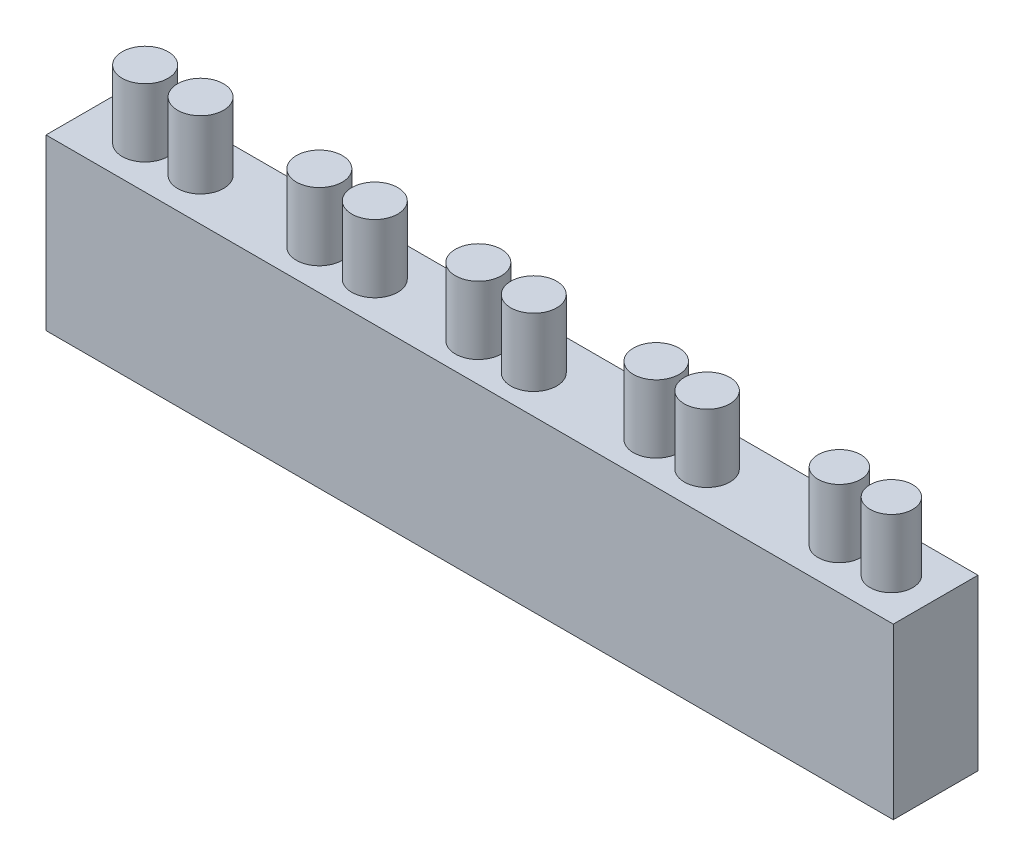
from build123d import *

# Parameters (mm, degrees)
SKETCH1_W           = 100
SKETCH1_H           = 10
BOSS_EXTRUDE1_DEPTH = 20
SKETCH2_R           = 2.713153407
SKETCH2_R_2         = 2.694189889
SKETCH2_R_3         = 2.523769014
BOSS_EXTRUDE2_DEPTH = 8


with BuildPart() as part:
    # Sketch1 → Boss-Extrude1 (new body)
    with BuildSketch(Plane(origin=(0, 0, 0), x_dir=(1, 0, 0), z_dir=(0, 1, 0))):
        Rectangle(SKETCH1_W, SKETCH1_H)
    extrude(amount=BOSS_EXTRUDE1_DEPTH)

    # Sketch2 → Boss-Extrude2 (add)
    with BuildSketch(Plane(origin=(0, 20, 0), x_dir=(1, 0, 0), z_dir=(0, 1, 0))):
        with Locations(Location((-43.29861016, 0, 0), (0, 0, 270))):
            Circle(SKETCH2_R)
        with Locations(Location((-36.758074643, 0, 0), (0, 0, 270))):
            Circle(SKETCH2_R)
        with Locations(Location((-22.408108815, -0.328361024, 0), (0, 0, 270))):
            Circle(SKETCH2_R)
        with Locations(Location((-15.867573299, -0.328361024, 0), (0, 0, 270))):
            Circle(SKETCH2_R)
        with Locations(Location((17.140046294, -0.119001471, 0), (0, 0, 270))):
            Circle(SKETCH2_R_2)
        with Locations(Location((23.146948699, -0.119001471, 0), (0, 0, 270))):
            Circle(SKETCH2_R_2)
        with Locations(Location((38.761600382, -0.119001471, 0), (0, 0, 270))):
            Circle(SKETCH2_R_3)
        with Locations(Location((44.898381169, -0.119001471, 0), (0, 0, 270))):
            Circle(SKETCH2_R_3)
        with Locations(Location((-3.447043883, -0.524988506, 0), (0, 0, 270))):
            Circle(SKETCH2_R)
        with Locations(Location((3.093491634, -0.524988506, 0), (0, 0, 270))):
            Circle(SKETCH2_R)
    extrude(amount=BOSS_EXTRUDE2_DEPTH)


solid = part.part
